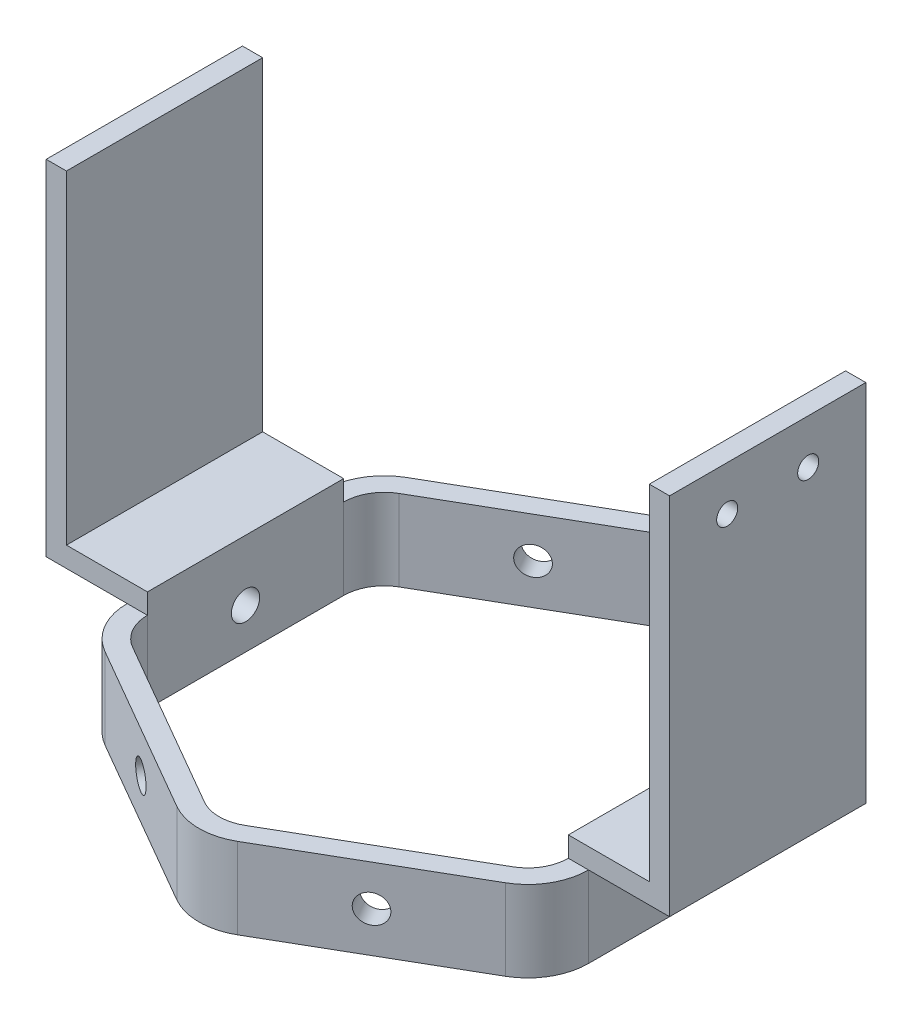
from build123d import *

# Parameters (mm, degrees)
Y_KSEKLIK_EKSTR_ZYON1_DEPTH = 20
IZIM3_W                     = 25
IZIM3_H                     = 48.452994616
Y_KSEKLIK_EKSTR_ZYON2_DEPTH = 5
IZIM12_R                    = 3.5
KES_EKSTR_ZYON4_DEPTH       = 200
KES_EKSTR_ZYON5_DEPTH       = 200
KES_EKSTR_ZYON5_DEPTH_BACK  = 200
IZIM13_R                    = 3.5
IZIM14_R                    = 3.5
KES_EKSTR_ZYON6_DEPTH       = 150
IZIM10_W                    = 5
IZIM10_H                    = 48.452994616
Y_KSEKLIK_EKSTR_ZYON3_DEPTH = 80
IZIM15_W                    = 5
IZIM15_H                    = 48.452994616
Y_KSEKLIK_EKSTR_ZYON4_DEPTH = 5
IZIM11_R                    = 2.6
KES_EKSTR_ZYON3_DEPTH       = 5.5


with BuildPart() as part:
    # Çizim1 → Yükseklik-Ekstrüzyon1 (new body)
    with BuildSketch(Plane(origin=(0, 0, 0), x_dir=(1, 0, 0), z_dir=(0, 1, 0))):
        with BuildLine():
            Line((-74.133721197, -34.978223844), (-74.133721197, 13.474770772))
            ThreePointArc((-74.133721197, 13.474770772), (-72.124102253, 20.974770772), (-66.633721197, 26.465151829))
            Line((-66.633721197, 26.465151829), (-24.672196969, 50.691649137))
            ThreePointArc((-24.672196969, 50.691649137), (-17.172196969, 52.70126808), (-9.672196969, 50.691649137))
            Line((-9.672196969, 50.691649137), (32.289327258, 26.465151829))
            ThreePointArc((32.289327258, 26.465151829), (37.779708314, 20.974770772), (39.789327258, 13.474770772))
            Line((39.789327258, 13.474770772), (39.789327258, -34.978223844))
            ThreePointArc((39.789327258, -34.978223844), (37.779708314, -42.478223844), (32.289327258, -47.968604901))
            Line((32.289327258, -47.968604901), (-9.672196969, -72.195102209))
            ThreePointArc((-9.672196969, -72.195102209), (-17.172196969, -74.204721152), (-24.672196969, -72.195102209))
            Line((-24.672196969, -72.195102209), (-66.633721197, -47.968604901))
            ThreePointArc((-66.633721197, -47.968604901), (-72.124102253, -42.478223844), (-74.133721197, -34.978223844))
        make_face()
        with BuildLine():
            Line((-69.133721197, 13.474770772), (-69.133721197, -34.978223844))
            ThreePointArc((-69.133721197, -34.978223844), (-67.793975234, -39.978223844), (-64.133721197, -43.638477882))
            Line((-64.133721197, -43.638477882), (-22.172196969, -67.86497519))
            ThreePointArc((-22.172196969, -67.86497519), (-17.172196969, -69.204721152), (-12.172196969, -67.86497519))
            Line((-12.172196969, -67.86497519), (29.789327258, -43.638477882))
            ThreePointArc((29.789327258, -43.638477882), (33.449581295, -39.978223844), (34.789327258, -34.978223844))
            Line((34.789327258, -34.978223844), (34.789327258, 13.474770772))
            ThreePointArc((34.789327258, 13.474770772), (33.449581295, 18.474770772), (29.789327258, 22.13502481))
            Line((29.789327258, 22.13502481), (-12.172196969, 46.361522118))
            ThreePointArc((-12.172196969, 46.361522118), (-17.172196969, 47.70126808), (-22.172196969, 46.361522118))
            Line((-22.172196969, 46.361522118), (-64.133721197, 22.13502481))
            ThreePointArc((-64.133721197, 22.13502481), (-67.793975234, 18.474770772), (-69.133721197, 13.474770772))
        make_face(mode=Mode.SUBTRACT)
    extrude(amount=Y_KSEKLIK_EKSTR_ZYON1_DEPTH)

    # Çizim3 → Yükseklik-Ekstrüzyon2 (add)
    with BuildSketch(Plane(origin=(0, 20, 0), x_dir=(1, 0, 0), z_dir=(0, 1, 0))):
        with Locations((-81.633721197, -10.751726536)):
            Rectangle(IZIM3_W, IZIM3_H)
        with Locations((47.289327258, -10.751726536)):
            Rectangle(IZIM3_W, IZIM3_H)
    extrude(amount=Y_KSEKLIK_EKSTR_ZYON2_DEPTH)

    # Çizim12 → Kes-Ekstrüzyon4 (cut)
    with BuildSketch(Plane(origin=(39.789327258, 0, 0), x_dir=(0, 0, -1), z_dir=(1, 0, 0))):
        with Locations((-10.751726536, 10)):
            Circle(IZIM12_R)
    extrude(amount=-KES_EKSTR_ZYON4_DEPTH, mode=Mode.SUBTRACT)

    # Çizim13 → Kes-Ekstrüzyon5 (cut, two sides: drawn at the far end of the back side and taken through both)
    with BuildSketch(Plane(origin=(10.467209436, 0, -39.064157428), x_dir=(0.8660254037844397, 0, 0.4999999999999982), z_dir=(-0.4999999999999983, 0, 0.8660254037844398)).offset(-KES_EKSTR_ZYON5_DEPTH_BACK)):
        with Locations(Location((0.971513889, 10, 0), (0, 0, 180))):
            Circle(IZIM13_R)
    extrude(amount=KES_EKSTR_ZYON5_DEPTH + KES_EKSTR_ZYON5_DEPTH_BACK, mode=Mode.SUBTRACT)

    # Çizim14 → Kes-Ekstrüzyon6 (cut)
    with BuildSketch(Plane(origin=(-28.118177199, 0, -48.702111524), x_dir=(-0.8660254037844375, 0, 0.500000000000002), z_dir=(-0.500000000000002, 0, -0.8660254037844375))):
        with Locations((20.247422082, 10)):
            Circle(IZIM14_R)
    extrude(amount=-KES_EKSTR_ZYON6_DEPTH, mode=Mode.SUBTRACT)

    # Çizim10 → Yükseklik-Ekstrüzyon3 (add)
    with BuildSketch(Plane(origin=(0, 25, 0), x_dir=(1, 0, 0), z_dir=(0, 1, 0))):
        with Locations((57.289327258, -10.751726536)):
            Rectangle(IZIM10_W, IZIM10_H)
        with Locations((-91.633721197, -10.751726536)):
            Rectangle(IZIM10_W, IZIM10_H)
    extrude(amount=Y_KSEKLIK_EKSTR_ZYON3_DEPTH)

    # Çizim15 → Yükseklik-Ekstrüzyon4 (add)
    with BuildSketch(Plane(origin=(0, 105, 0), x_dir=(1, 0, 0), z_dir=(0, 1, 0))):
        with Locations((57.289327258, -10.751726536)):
            Rectangle(IZIM15_W, IZIM15_H)
    extrude(amount=Y_KSEKLIK_EKSTR_ZYON4_DEPTH)

    # Çizim11 → Kes-Ekstrüzyon3 (cut)
    with BuildSketch(Plane(origin=(54.789327258, 0, 0), x_dir=(0, 0, -1), z_dir=(1, 0, 0))):
        with Locations(Location((-20.750229228, 99, 0), (0, 0, 180))):
            Circle(IZIM11_R)
        with Locations(Location((-0.750229228, 99, 0), (0, 0, 180))):
            Circle(IZIM11_R)
    extrude(amount=KES_EKSTR_ZYON3_DEPTH, mode=Mode.SUBTRACT)


solid = part.part
